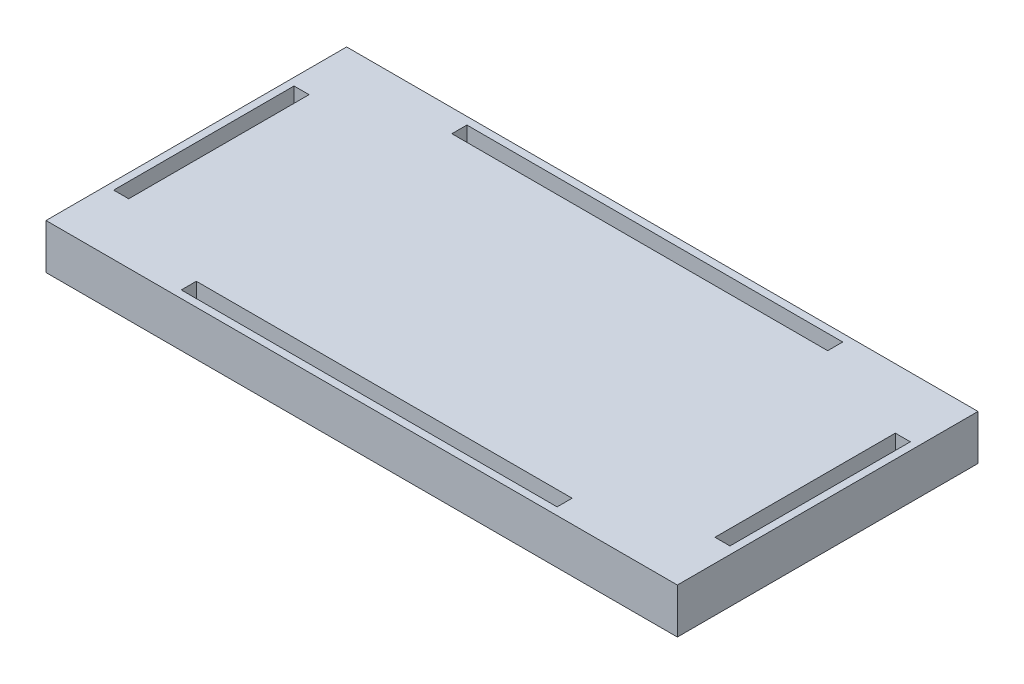
from build123d import *

# Parameters (mm, degrees)
BOSS_EXTRUDE1_DEPTH = 15
SKETCH5_W           = 5
SKETCH5_H           = 60
SKETCH5_W_2         = 125
SKETCH5_H_2         = 5
CUT_EXTRUDE2_DEPTH  = 5


with BuildPart() as part:
    # Sketch1 → Boss-Extrude1 (new body)
    with BuildSketch(Plane(origin=(0, 0, 0), x_dir=(1, 0, 0), z_dir=(0, 1, 0))):
        Polygon((-105, 48), (-105, 50), (-103, 50), (103, 50), (105, 50), (105, 48), (105, -48), (105, -50), (103, -50), (-103, -50), (-105, -50), (-105, -48), align=None)
    extrude(amount=BOSS_EXTRUDE1_DEPTH)

    # Sketch5 → Cut-Extrude2 (cut)
    with BuildSketch(Plane(origin=(0, 15, 0), x_dir=(1, 0, 0), z_dir=(0, 1, 0))):
        with Locations((100, 0)):
            Rectangle(SKETCH5_W, SKETCH5_H)
        with Locations((-100, 0)):
            Rectangle(SKETCH5_W, SKETCH5_H)
        with Locations((0, -45)):
            Rectangle(SKETCH5_W_2, SKETCH5_H_2)
        with Locations((0, 45)):
            Rectangle(SKETCH5_W_2, SKETCH5_H_2)
    extrude(amount=-CUT_EXTRUDE2_DEPTH, mode=Mode.SUBTRACT)


solid = part.part
